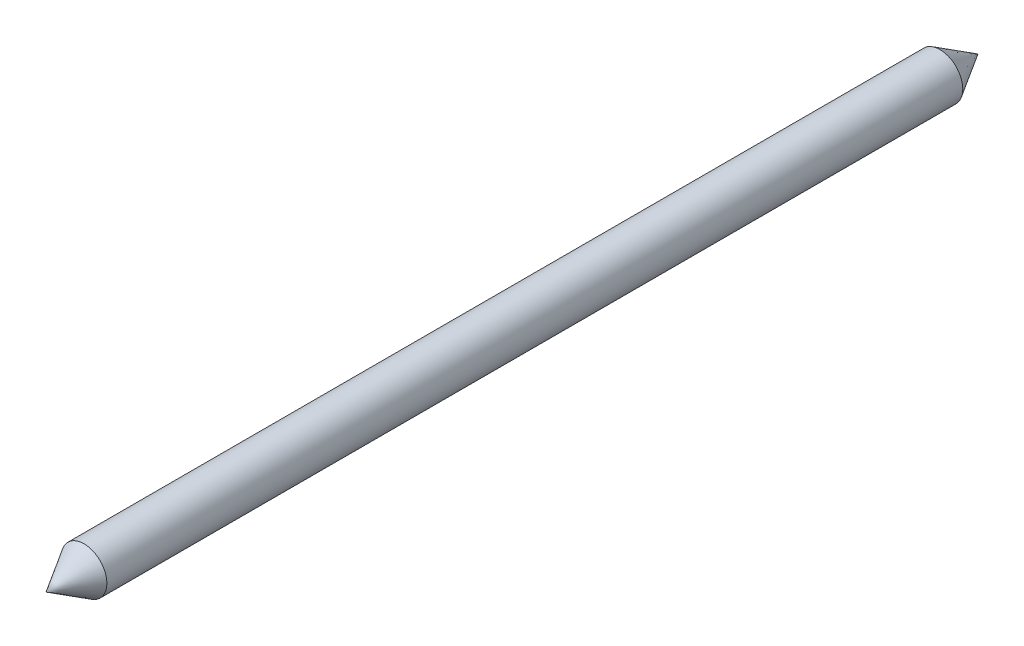
from build123d import *


with BuildPart() as part:
    # Sketch1 → Revolve1 (revolve)
    with BuildSketch(Plane(origin=(0, 0, 0), x_dir=(1, 0, 0), z_dir=(0, 1, 0)), mode=Mode.PRIVATE) as revolve1_sk:
        Polygon((7.62, 142.875), (7.62, -142.875), (0, -155.575), (0, 155.575), align=None)
    revolve(revolve1_sk.sketch.rotate(Axis((0, 0, -155.575), (0, 0, 1)), 180), axis=Axis((0, 0, -155.575), (0, 0, 1)))


solid = part.part
